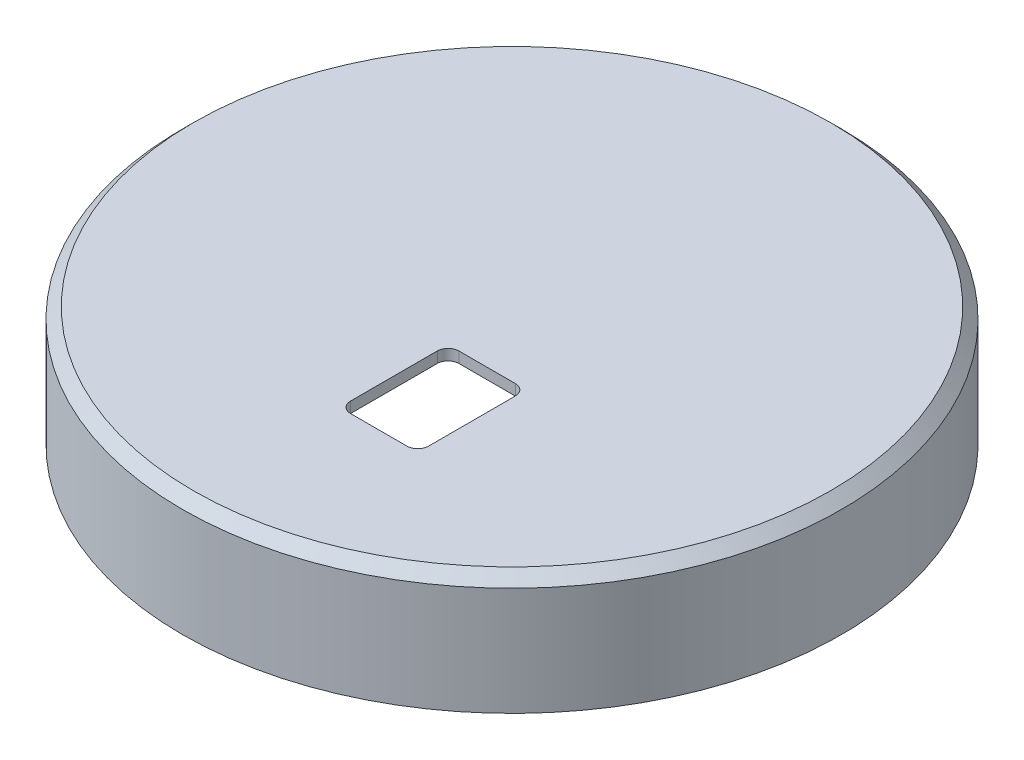
from build123d import *

# Parameters (mm, degrees)
SKIZZE1_R                       = 30.405
SKIZZE1_R_2                     = 28.405
AUFSATZ_LINEAR_AUSTRAGEN1_DEPTH = 10
SKIZZE2_R                       = 30.405
AUFSATZ_LINEAR_AUSTRAGEN2_DEPTH = 1
AUFSATZ_LINEAR_START            = 10
AUFSATZ_LINEAR_AUSTRAGEN3_DEPTH = 10
SKIZZE5_R                       = 1.5
SCHNITT_LINEAR_AUSTRAGEN2_DEPTH = 10
SKIZZE6_W                       = 7.2
SKIZZE6_H                       = 10
SCHNITT_LINEAR_AUSTRAGEN3_DEPTH = 10
KREISMUSTER1_COUNT              = 2
KREISMUSTER1_ANGLE              = 90
FASE1_SIZE                      = 1
VERRUNDUNG1_R                   = 2
VERRUNDUNG2_R                   = 1
FASE2_SIZE                      = 1


with BuildPart() as part:
    # Skizze1 → Aufsatz-Linear austragen1 (new body)
    with BuildSketch(Plane(origin=(0, 0, 0), x_dir=(1, 0, 0), z_dir=(0, 1, 0))):
        with Locations(Location((0, 0, 0), (0, 0, 270))):
            Circle(SKIZZE1_R)
        with Locations(Location((0, 0, 0), (0, 0, 270))):
            Circle(SKIZZE1_R_2, mode=Mode.SUBTRACT)
    extrude(amount=AUFSATZ_LINEAR_AUSTRAGEN1_DEPTH)

    # Skizze2 → Aufsatz-Linear austragen2 (add)
    with BuildSketch(Plane(origin=(0, 10, 0), x_dir=(1, 0, 0), z_dir=(0, 1, 0))):
        with Locations(Location((0, 0, 0), (0, 0, 270))):
            Circle(SKIZZE2_R)
    extrude(amount=AUFSATZ_LINEAR_AUSTRAGEN2_DEPTH)

    # Skizze4 → Aufsatz-Linear austragen3 (add)
    with BuildSketch(Plane.XZ.offset(-10).offset(AUFSATZ_LINEAR_START)):
        with BuildLine():
            ThreePointArc((-28.07385528, -4.324658914), (-23.255, 0), (-28.07385528, 4.324658914))
            ThreePointArc((-28.07385528, 4.324658914), (-28.405, 0), (-28.07385528, -4.324658914))
        make_face()
        with BuildLine():
            ThreePointArc((28.405, 0), (28.322092827, 2.168659237), (28.07385528, 4.324658914))
            ThreePointArc((28.07385528, 4.324658914), (23.255, 0), (28.07385528, -4.324658914))
            ThreePointArc((28.07385528, -4.324658914), (28.322092827, -2.168659237), (28.405, 0))
        make_face()
    aufsatz_linear_austragen3 = extrude(amount=-AUFSATZ_LINEAR_AUSTRAGEN3_DEPTH)

    # Skizze5 → Schnitt-Linear austragen2 (cut)
    with BuildSketch(Plane.XZ):
        with Locations(Location((-27.605, 0, 0), (0, 0, 270))):
            Circle(SKIZZE5_R)
        with BuildLine():
            ThreePointArc((29.105, 0), (27.605, 1.5), (26.105, 0))
            Line((26.105, 0), (29.105, 0))
        make_face()
        with BuildLine():
            Line((29.105, 0), (26.105, 0))
            ThreePointArc((26.105, 0), (27.605, -1.5), (29.105, 0))
        make_face()
    schnitt_linear_austragen2 = extrude(amount=-SCHNITT_LINEAR_AUSTRAGEN2_DEPTH, mode=Mode.SUBTRACT)

    # Skizze6 → Schnitt-Linear austragen3 (cut)
    with BuildSketch(Plane(origin=(0, 11, 0), x_dir=(1, 0, 0), z_dir=(0, 1, 0))):
        with Locations((3.69194255, -10.988)):
            Rectangle(SKIZZE6_W, SKIZZE6_H)
    extrude(amount=-SCHNITT_LINEAR_AUSTRAGEN3_DEPTH, mode=Mode.SUBTRACT)

    # Kreismuster1: Aufsatz-Linear austragen3, Schnitt-Linear austragen2 ×2 about axis
    kreismuster1_axis = Axis((0, 0, 0), (0, 1, 0))
    add([aufsatz_linear_austragen3.rotate(kreismuster1_axis, i * KREISMUSTER1_ANGLE / (KREISMUSTER1_COUNT - 1)) for i in range(1, KREISMUSTER1_COUNT)])
    add([schnitt_linear_austragen2.rotate(kreismuster1_axis, i * KREISMUSTER1_ANGLE / (KREISMUSTER1_COUNT - 1)) for i in range(1, KREISMUSTER1_COUNT)], mode=Mode.SUBTRACT)

    # Fase1
    fase1_edges = [part.edges().sort_by_distance(p)[0] for p in [
        (0, 11, -30.405),
    ]]
    chamfer(fase1_edges, length=FASE1_SIZE)

    # Verrundung1
    verrundung1_edges = [part.edges().sort_by_distance(p)[0] for p in [
        (-28.07385528, 5, 4.324658914),
        (-28.07385528, 5, -4.324658914),
        (28.07385528, 5, 4.324658914),
        (28.07385528, 5, -4.324658914),
        (4.324658914, 5, 28.07385528),
        (-4.324658914, 5, 28.07385528),
        (4.324658914, 5, -28.07385528),
        (-4.324658914, 5, -28.07385528),
    ]]
    fillet(verrundung1_edges, radius=VERRUNDUNG1_R)

    # Verrundung2
    verrundung2_edges = [part.edges().sort_by_distance(p)[0] for p in [
        (7.29194255, 10.5, 5.988),
        (7.29194255, 10.5, 15.988),
        (0.09194255, 10.5, 15.988),
        (0.09194255, 10.5, 5.988),
    ]]
    fillet(verrundung2_edges, radius=VERRUNDUNG2_R)

    # Fase2
    fase2_edges = [part.edges().sort_by_distance(p)[0] for p in [
        (-20.08536812, 10, -20.08536812),
        (0, 10, -23.255),
        (20.08536812, 10, -20.08536812),
        (23.255, 10, 0),
        (20.08536812, 10, 20.08536812),
        (0, 10, 23.255),
        (-20.08536812, 10, 20.08536812),
        (-23.255, 10, 0),
        (-5.068546935, 10, 27.438977106),
        (5.068546935, 10, 27.438977106),
        (-27.438977106, 10, -5.068546935),
        (-27.438977106, 10, 5.068546935),
        (27.438977106, 10, 5.068546935),
        (27.438977106, 10, -5.068546935),
        (5.068546935, 10, -27.438977106),
        (-5.068546935, 10, -27.438977106),
    ]]
    chamfer(fase2_edges, length=FASE2_SIZE)


solid = part.part
